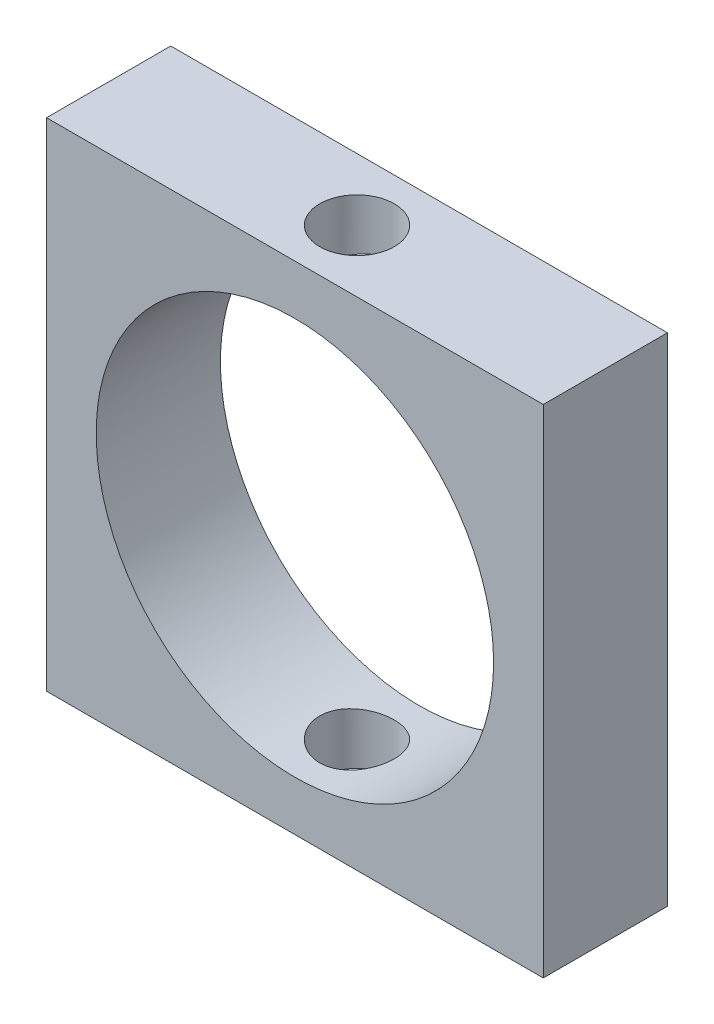
from build123d import *

# Parameters (mm, degrees)
SKETCH1_W           = 20
SKETCH1_H           = 20
SKETCH1_R           = 8
BOSS_EXTRUDE1_DEPTH = 5
SKETCH3_R           = 1.5
CUT_EXTRUDE1_DEPTH  = 20


with BuildPart() as part:
    # Sketch1 → Boss-Extrude1 (new body)
    with BuildSketch(Plane.XY):
        Rectangle(SKETCH1_W, SKETCH1_H)
        Circle(SKETCH1_R, mode=Mode.SUBTRACT)
    extrude(amount=BOSS_EXTRUDE1_DEPTH)

    # Sketch3 → Cut-Extrude1 (cut)
    with BuildSketch(Plane(origin=(0, 10, 0), x_dir=(1, 0, 0), z_dir=(0, 1, 0))):
        with Locations(Location((0, -2.5, 0), (0, 0, 270))):
            Circle(SKETCH3_R)
    extrude(amount=-CUT_EXTRUDE1_DEPTH, mode=Mode.SUBTRACT)


solid = part.part
